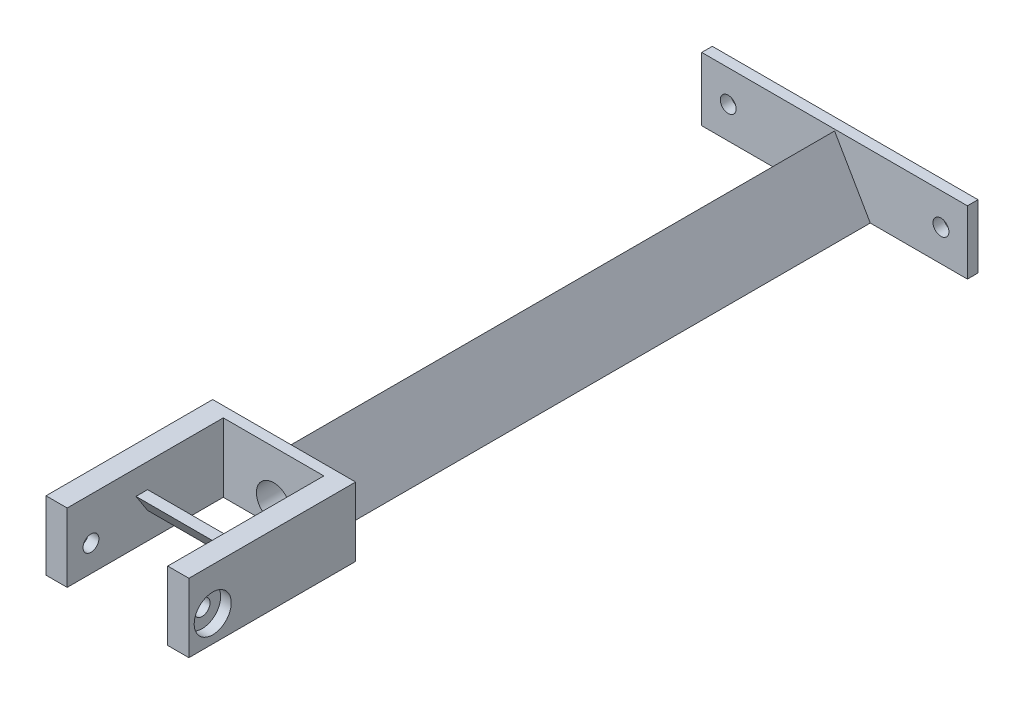
from build123d import *

# Parameters (mm, degrees)
SKETCH_1_W                     = 50.2
SKETCH_1_H                     = 22
EXTRUDE_1_DEPTH                = 2.5
SKETCH_2_R                     = 1.5
CUT_EXTRUDE_1_DEPTH            = 2.5
SKETCH_4_W                     = 4
SKETCH_4_H                     = 16
EXTRUDE_2_DEPTH                = 87
EXTRUDE_3_REACH                = 100.673
SKETCH_5_R                     = 2
CUT_EXTRUDE_2_DEPTH            = 99.673248654
CUT_EXTRUDE_2_DEPTH_BACK       = 99.673248654
SKETCH_6_R                     = 1.5
SKETCH_7_R                     = 3.5
CUT_EXTRUDE_3_DEPTH            = 2
FILLET_1_R                     = 2
SKETCH_8_W                     = 50.2
SKETCH_8_H                     = 2.5
EXTRUDE_4_DEPTH                = 3
EXTRUDE_8_DEPTH                = 22
SKETCH_16_W                    = 51.125372974
SKETCH_16_H                    = 33.398780813
CUT_EXTRUDE_4_DEPTH            = 60
SKETCH_17_W                    = 27
SKETCH_17_H                    = 16
EXTRUDE_9_DEPTH                = 2
EXTRUDE_11_DEPTH               = 104
SKETCH_19_W                    = 50.2
SKETCH_19_H                    = 29
EXTRUDE_12_DEPTH               = 2
SKETCH_20_R                    = 1.5
CUT_EXTRUDE_5_DEPTH            = 8
SPLIT_BODIES_1_SURFACE_1_BACK  = 150.222
SPLIT_BODIES_1_SURFACE_1_DEPTH = 300.444
SPLIT_BODIES_1_SURFACE_2_BACK  = 150.222
SPLIT_BODIES_1_SURFACE_2_DEPTH = 300.444
CUT_EXTRUDE_7_DEPTH            = 164
CUT_EXTRUDE_7_DEPTH_BACK       = 164
SKETCH_21_W                    = 50.2
SKETCH_21_H                    = 17
CUT_EXTRUDE_9_DEPTH            = 10
CUT_EXTRUDE_9_DEPTH_BACK       = 110
SKETCH_26_R                    = 3.25


with BuildPart() as part:
    # 草图1 → 凸台-拉伸1 (new body)
    with BuildSketch(Plane.XY):
        with Locations((0, -5)):
            Rectangle(SKETCH_1_W, SKETCH_1_H)
    extrude(amount=EXTRUDE_1_DEPTH)

    # 草图2 → 切除-拉伸1 (cut)
    with BuildSketch(Plane.XY.offset(2.5)):
        with Locations((-20.1, 0)):
            Circle(SKETCH_2_R)
        with Locations(Location((20.1, 0, 0), (0, 0, 180))):
            Circle(SKETCH_2_R)
    extrude(amount=-CUT_EXTRUDE_1_DEPTH, mode=Mode.SUBTRACT)

    # 草图4 → 凸台-拉伸2 (add)
    with BuildSketch(Plane.XY.offset(2.5)):
        with Locations((-11.5, -15)):
            Rectangle(SKETCH_4_W, SKETCH_4_H)
        with Locations((11.5, -15)):
            Rectangle(SKETCH_4_W, SKETCH_4_H)
    extrude(amount=EXTRUDE_2_DEPTH)

    # 草图5 → 凸台-拉伸3 (add, up to next)
    with BuildSketch(Plane.ZY.offset(-9.5), mode=Mode.PRIVATE) as extrude_3_sk1:
        with Locations((46, -15)):
            Circle(SKETCH_5_R)
    extrude_3_tool1 = extrude(extrude_3_sk1.sketch, amount=EXTRUDE_3_REACH, mode=Mode.PRIVATE) - part.part
    add(extrude_3_tool1.solids().sort_by_distance((9.5, -15, 46))[0])

    # 草图6 → 切除-拉伸2 (cut, two sides: drawn at the far end of the back side and taken through both)
    with BuildSketch(Plane(origin=(-9.5, 0, 0), x_dir=(0, 0, -1), z_dir=(1, 0, 0)).offset(-CUT_EXTRUDE_2_DEPTH_BACK)):
        with Locations(Location((-85, -15, 0), (0, 0, 270))):
            Circle(SKETCH_6_R)
    extrude(amount=CUT_EXTRUDE_2_DEPTH + CUT_EXTRUDE_2_DEPTH_BACK, mode=Mode.SUBTRACT)

    # 草图7 → 切除-拉伸3 (cut)
    with BuildSketch(Plane.ZY.offset(13.5)):
        with Locations(Location((85, -15, 0), (0, 0, 270))):
            Circle(SKETCH_7_R)
    cut_extrude_3 = extrude(amount=-CUT_EXTRUDE_3_DEPTH, mode=Mode.SUBTRACT)

    # 镜向1: 切除-拉伸3 across plane
    add(cut_extrude_3.mirror(Plane(origin=(0, 0, 0), x_dir=(0, 0, 1), z_dir=(1, 0, 0))), mode=Mode.SUBTRACT)

    # 圆角1
    fillet_1_edges = [part.edges().sort_by_distance(p)[0] for p in [
        (-11.5, -16, 2.5),
        (11.5, -16, 2.5),
    ]]
    fillet(fillet_1_edges, radius=FILLET_1_R)

    # 草图8 → 凸台-拉伸4 (add)
    with BuildSketch(Plane(origin=(0, 6, 0), x_dir=(1, 0, 0), z_dir=(0, 1, 0))):
        with Locations((0, -1.25)):
            Rectangle(SKETCH_8_W, SKETCH_8_H)
    extrude(amount=EXTRUDE_4_DEPTH)

    # 草图15 → 凸台-拉伸8 (add)
    with BuildSketch(Plane.ZY.offset(-9.5)):
        Polygon((74.3, -11.6), (76.5, -11.6), (74.3, -15), align=None)
    extrude(amount=EXTRUDE_8_DEPTH)

    # 草图16 → 切除-拉伸4 (cut)
    with BuildSketch(Plane(origin=(0, 0, 0), x_dir=(-1, 0, 0), z_dir=(0, 0, -1))):
        with Locations((0.462686487, -7.699390407)):
            Rectangle(SKETCH_16_W, SKETCH_16_H)
    extrude(amount=-CUT_EXTRUDE_4_DEPTH, mode=Mode.SUBTRACT)

    # 草图17 → 凸台-拉伸9 (add)
    with BuildSketch(Plane(origin=(0, 0, 60), x_dir=(-1, 0, 0), z_dir=(0, 0, -1))):
        with Locations((0, -15)):
            Rectangle(SKETCH_17_W, SKETCH_17_H)
    extrude(amount=EXTRUDE_9_DEPTH)

    # 草图18 → 凸台-拉伸11 (add)
    with BuildSketch(Plane(origin=(0, 0, 58), x_dir=(-1, 0, 0), z_dir=(0, 0, -1))):
        Polygon((0, -8.308657049), (-6.75, -20), (6.75, -20), align=None)
    extrude(amount=EXTRUDE_11_DEPTH)

    # 草图19 → 凸台-拉伸12 (add)
    with BuildSketch(Plane(origin=(0, 0, -46), x_dir=(-1, 0, 0), z_dir=(0, 0, -1))):
        with Locations((0, -8.5)):
            Rectangle(SKETCH_19_W, SKETCH_19_H)
    extrude(amount=EXTRUDE_12_DEPTH)

    # 草图20 → 切除-拉伸5 (cut)
    with BuildSketch(Plane.XY.offset(-46)):
        with Locations((-20.1, 0)):
            Circle(SKETCH_20_R)
        with Locations((20.1, 0)):
            Circle(SKETCH_20_R)
    extrude(amount=-CUT_EXTRUDE_5_DEPTH, mode=Mode.SUBTRACT)


with BuildPart() as body_2:
    # Split Bodies 1: the piece behind the surface
    add(part.part)
    # Split Bodies 1 surface: a surface, the sketch's curves swept straight by 300.444 mm
    with BuildLine(Plane(origin=(25.1, 0, 0), x_dir=(0, 0, -1), z_dir=(1, 0, 0)).offset(-SPLIT_BODIES_1_SURFACE_1_BACK), mode=Mode.PRIVATE) as split_bodies_1_surface_1_path:
        Line((46, -8), (46, -23))
    split_bodies_1_surface_1 = Shell.extrude(split_bodies_1_surface_1_path.wire(), (1 * SPLIT_BODIES_1_SURFACE_1_DEPTH, 0 * SPLIT_BODIES_1_SURFACE_1_DEPTH, 0 * SPLIT_BODIES_1_SURFACE_1_DEPTH))
    split(bisect_by=split_bodies_1_surface_1, keep=Keep.BOTTOM)


with BuildPart() as part_1:
    add(part.part)

    # Split Bodies 1: split by a surface, the side it looks to stays
    # Split Bodies 1 surface: a surface, the sketch's curves swept straight by 300.444 mm
    with BuildLine(Plane(origin=(25.1, 0, 0), x_dir=(0, 0, -1), z_dir=(1, 0, 0)).offset(-SPLIT_BODIES_1_SURFACE_2_BACK), mode=Mode.PRIVATE) as split_bodies_1_surface_2_path:
        Line((46, -8), (46, -23))
    split_bodies_1_surface_2 = Shell.extrude(split_bodies_1_surface_2_path.wire(), (1 * SPLIT_BODIES_1_SURFACE_2_DEPTH, 0 * SPLIT_BODIES_1_SURFACE_2_DEPTH, 0 * SPLIT_BODIES_1_SURFACE_2_DEPTH))
    split(bisect_by=split_bodies_1_surface_2, keep=Keep.TOP)


with BuildPart() as body_3:
    # Move Body 1: copy of body 2
    add(body_2.part.moved(Location((0, 14, 0))))


with BuildPart() as cut_extrude_7_tool:
    # 草图21 → 切除-拉伸7 (new, two sides: drawn at the far end of the back side and taken through both)
    with BuildSketch(Plane.XY.offset(-46).offset(-CUT_EXTRUDE_7_DEPTH_BACK)):
        with Locations((0, -14.5)):
            Rectangle(SKETCH_21_W, SKETCH_21_H)
    extrude(amount=CUT_EXTRUDE_7_DEPTH + CUT_EXTRUDE_7_DEPTH_BACK)


with BuildPart() as part_2:
    add(part_1.part)

    # 切除-拉伸7: cut by cut_extrude_7_tool
    add(cut_extrude_7_tool.part, mode=Mode.SUBTRACT)


with BuildPart() as body_2_1:
    add(body_2.part)

    # 切除-拉伸7: cut by cut_extrude_7_tool
    add(cut_extrude_7_tool.part, mode=Mode.SUBTRACT)


with BuildPart() as body_3_1:
    add(body_3.part)

    # 切除-拉伸7: cut by cut_extrude_7_tool
    add(cut_extrude_7_tool.part, mode=Mode.SUBTRACT)


with BuildPart() as cut_extrude_9_tool:
    # 草图26 → 切除-拉伸9 (new, two sides: drawn at the far end of the back side and taken through both)
    with BuildSketch(Plane(origin=(0, 0, -48), x_dir=(-1, 0, 0), z_dir=(0, 0, -1)).offset(-CUT_EXTRUDE_9_DEPTH_BACK)):
        with Locations(Location((0, -2.1, 0), (0, 0, 180))):
            Circle(SKETCH_26_R)
    extrude(amount=CUT_EXTRUDE_9_DEPTH + CUT_EXTRUDE_9_DEPTH_BACK)


with BuildPart() as part_3:
    add(part_2.part)

    # 切除-拉伸9: cut by cut_extrude_9_tool
    add(cut_extrude_9_tool.part, mode=Mode.SUBTRACT)


with BuildPart() as body_3_2:
    add(body_3_1.part)

    # 切除-拉伸9: cut by cut_extrude_9_tool
    add(cut_extrude_9_tool.part, mode=Mode.SUBTRACT)


solid = Compound([part_3.part, body_3_2.part])
